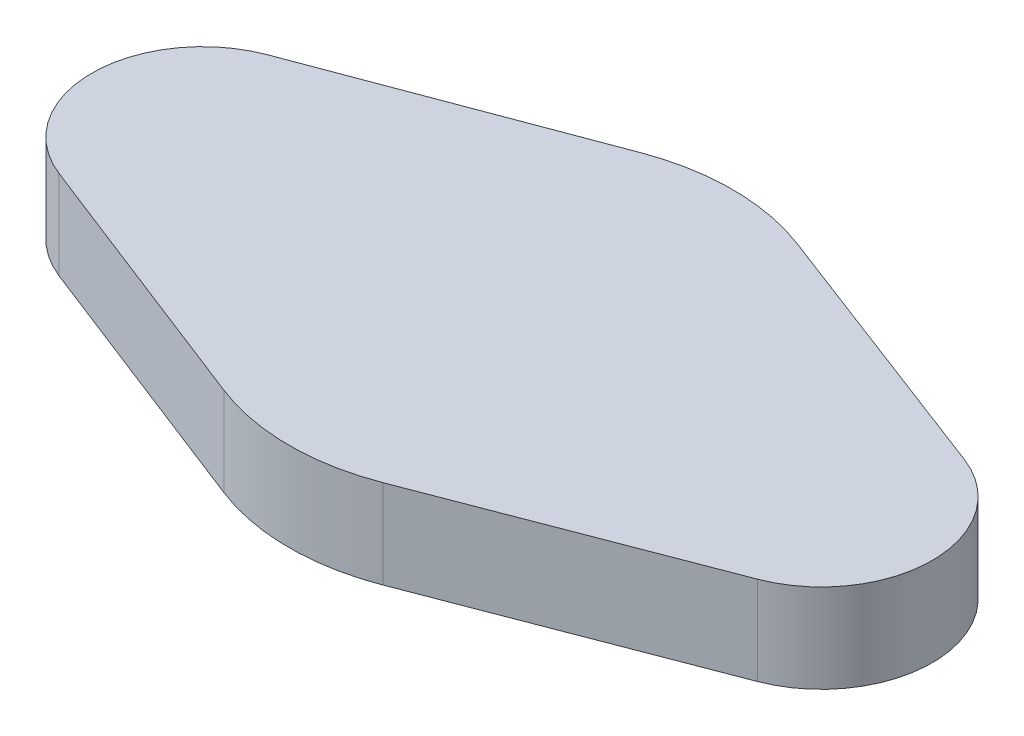
from build123d import *

# Parameters (mm, degrees)
EXTRUDE_315_DEPTH = 20


with BuildPart() as part:
    # Эскиз1 → Extrude 315 (new body)
    with BuildSketch(Plane(origin=(0, 0, 0), x_dir=(-1, 0, 0), z_dir=(0, -1, 0))):
        with BuildLine():
            Line((-78.917505692, 23.388614652), (-17.835027079, 46.710938859))
            ThreePointArc((-17.835027079, 46.710938859), (-0.148812417, 49.999778548), (17.556665634, 46.816273793))
            Line((17.556665634, 46.816273793), (78.776887546, 23.857954408))
            ThreePointArc((78.776887546, 23.857954408), (94.998038561, 0.610466623), (79.076996078, -22.84357002))
            Line((79.076996078, -22.84357002), (18.156882698, -46.586775062))
            ThreePointArc((18.156882698, -46.586775062), (0.148812417, -49.999778548), (-17.879254632, -46.694028031))
            Line((-17.879254632, -46.694028031), (-78.939619469, -23.313868793))
            ThreePointArc((-78.939619469, -23.313868793), (-94.99998935, 0.044982802), (-78.917505692, 23.388614652))
        make_face()
    extrude(amount=EXTRUDE_315_DEPTH)


solid = part.part
